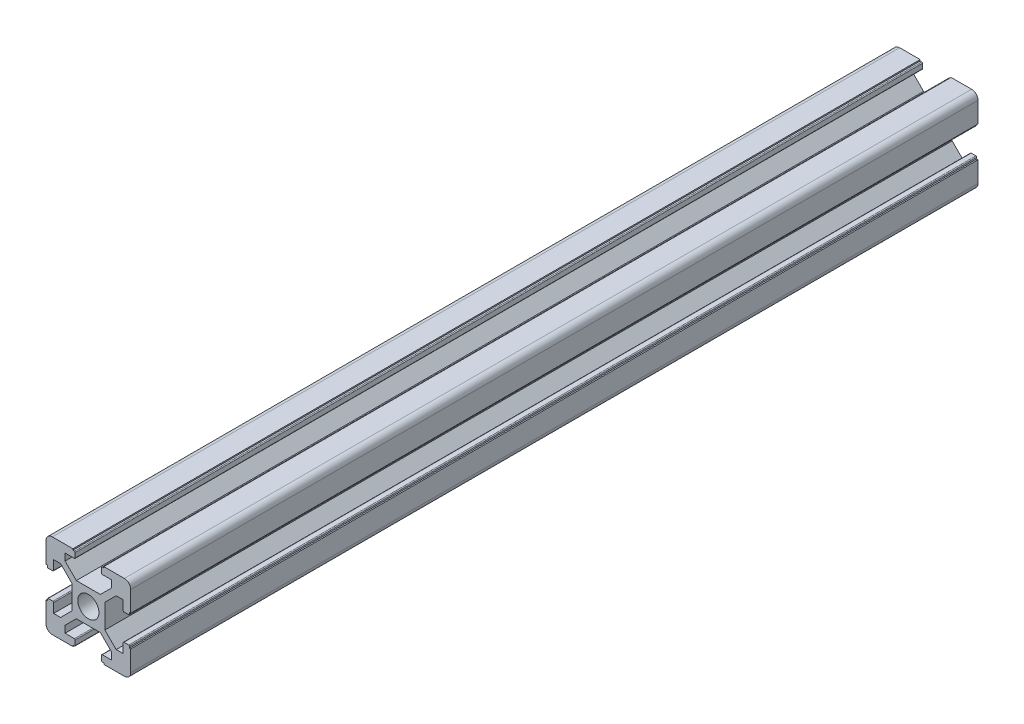
from build123d import *

# Parameters (mm, degrees)
SKETCH_1_R      = 2.5
EXTRUDE_2_DEPTH = 200
EXTRUDE_3_DEPTH = 200


with BuildPart() as part:
    # 草图1 → 凸台-拉伸2 (new body)
    with BuildSketch(Plane.XY):
        with BuildLine():
            Line((3.65, 10), (8.5, 10))
            ThreePointArc((8.5, 10), (9.560660172, 9.560660172), (10, 8.5))
            Line((10, 8.5), (10, 3.65))
            Line((10, 3.65), (8.2, 3.65))
            Line((8.2, 3.65), (8.2, 5.5))
            Line((8.2, 5.5), (6.560660172, 5.5))
            Line((6.560660172, 5.5), (3.9, 2.839339828))
            Line((3.9, 2.839339828), (3.9, -2.839339828))
            Line((3.9, -2.839339828), (6.560660172, -5.5))
            Line((6.560660172, -5.5), (8.2, -5.5))
            Line((8.2, -5.5), (8.2, -3.65))
            Line((8.2, -3.65), (10, -3.65))
            Line((10, -3.65), (10, -8.5))
            ThreePointArc((10, -8.5), (9.560660172, -9.560660172), (8.5, -10))
            Line((8.5, -10), (3.65, -10))
            Line((3.65, -10), (3.65, -8.2))
            Line((3.65, -8.2), (5.5, -8.2))
            Line((5.5, -8.2), (5.5, -6.560660172))
            Line((5.5, -6.560660172), (2.839339828, -3.9))
            Line((2.839339828, -3.9), (-2.839339828, -3.9))
            Line((-2.839339828, -3.9), (-5.5, -6.560660172))
            Line((-5.5, -6.560660172), (-5.5, -8.2))
            Line((-5.5, -8.2), (-3.65, -8.2))
            Line((-3.65, -8.2), (-3.65, -10))
            Line((-3.65, -10), (-8.5, -10))
            ThreePointArc((-8.5, -10), (-9.560660172, -9.560660172), (-10, -8.5))
            Line((-10, -8.5), (-10, -3.65))
            Line((-10, -3.65), (-8.2, -3.65))
            Line((-8.2, -3.65), (-8.2, -5.5))
            Line((-8.2, -5.5), (-6.560660172, -5.5))
            Line((-6.560660172, -5.5), (-3.9, -2.839339828))
            Line((-3.9, -2.839339828), (-3.9, 2.839339828))
            Line((-3.9, 2.839339828), (-6.560660172, 5.5))
            Line((-6.560660172, 5.5), (-8.2, 5.5))
            Line((-8.2, 5.5), (-8.2, 3.65))
            Line((-8.2, 3.65), (-10, 3.65))
            Line((-10, 3.65), (-10, 8.5))
            ThreePointArc((-10, 8.5), (-9.560660172, 9.560660172), (-8.5, 10))
            Line((-8.5, 10), (-3.65, 10))
            Line((-3.65, 10), (-3.65, 8.2))
            Line((-3.65, 8.2), (-5.5, 8.2))
            Line((-5.5, 8.2), (-5.5, 6.560660172))
            Line((-5.5, 6.560660172), (-2.839339828, 3.9))
            Line((-2.839339828, 3.9), (2.839339828, 3.9))
            Line((2.839339828, 3.9), (5.5, 6.560660172))
            Line((5.5, 6.560660172), (5.5, 8.2))
            Line((5.5, 8.2), (3.65, 8.2))
            Line((3.65, 8.2), (3.65, 10))
        make_face()
        Circle(SKETCH_1_R, mode=Mode.SUBTRACT)
    extrude(amount=EXTRUDE_2_DEPTH)

    # 草图3 → 凸台-拉伸3 (add)
    with BuildSketch(Plane.XY.offset(200)):
        with BuildLine():
            Line((-8.2, 3.65), (-9.7, 3.65))
            Line((-9.7, 3.65), (-9.7, 3.3))
            ThreePointArc((-9.7, 3.3), (-9.641421356, 3.158578644), (-9.5, 3.1))
            Line((-9.5, 3.1), (-8.4, 3.1))
            ThreePointArc((-8.4, 3.1), (-8.258578644, 3.158578644), (-8.2, 3.3))
            Line((-8.2, 3.3), (-8.2, 3.65))
        make_face()
        with BuildLine():
            Line((-3.65, 9.7), (-3.65, 8.2))
            Line((-3.65, 8.2), (-3.3, 8.2))
            ThreePointArc((-3.3, 8.2), (-3.158578644, 8.258578644), (-3.1, 8.4))
            Line((-3.1, 8.4), (-3.1, 9.5))
            ThreePointArc((-3.1, 9.5), (-3.158578644, 9.641421356), (-3.3, 9.7))
            Line((-3.3, 9.7), (-3.65, 9.7))
        make_face()
        with BuildLine():
            Line((3.65, 8.2), (3.65, 9.7))
            Line((3.65, 9.7), (3.3, 9.7))
            ThreePointArc((3.3, 9.7), (3.158578644, 9.641421356), (3.1, 9.5))
            Line((3.1, 9.5), (3.1, 8.4))
            ThreePointArc((3.1, 8.4), (3.158578644, 8.258578644), (3.3, 8.2))
            Line((3.3, 8.2), (3.65, 8.2))
        make_face()
        with BuildLine():
            Line((9.7, 3.65), (8.2, 3.65))
            Line((8.2, 3.65), (8.2, 3.3))
            ThreePointArc((8.2, 3.3), (8.258578644, 3.158578644), (8.4, 3.1))
            Line((8.4, 3.1), (9.5, 3.1))
            ThreePointArc((9.5, 3.1), (9.641421356, 3.158578644), (9.7, 3.3))
            Line((9.7, 3.3), (9.7, 3.65))
        make_face()
        with BuildLine():
            Line((3.65, -9.7), (3.65, -8.2))
            Line((3.65, -8.2), (3.3, -8.2))
            ThreePointArc((3.3, -8.2), (3.158578644, -8.258578644), (3.1, -8.4))
            Line((3.1, -8.4), (3.1, -9.5))
            ThreePointArc((3.1, -9.5), (3.158578644, -9.641421356), (3.3, -9.7))
            Line((3.3, -9.7), (3.65, -9.7))
        make_face()
        with BuildLine():
            Line((-3.65, -8.2), (-3.65, -9.7))
            Line((-3.65, -9.7), (-3.3, -9.7))
            ThreePointArc((-3.3, -9.7), (-3.158578644, -9.641421356), (-3.1, -9.5))
            Line((-3.1, -9.5), (-3.1, -8.4))
            ThreePointArc((-3.1, -8.4), (-3.158578644, -8.258578644), (-3.3, -8.2))
            Line((-3.3, -8.2), (-3.65, -8.2))
        make_face()
        with BuildLine():
            Line((8.2, -3.65), (8.2, -3.3))
            ThreePointArc((8.2, -3.3), (8.258578644, -3.158578644), (8.4, -3.1))
            Line((8.4, -3.1), (9.5, -3.1))
            ThreePointArc((9.5, -3.1), (9.641421356, -3.158578644), (9.7, -3.3))
            Line((9.7, -3.3), (9.7, -3.65))
            Line((9.7, -3.65), (8.2, -3.65))
        make_face()
        with BuildLine():
            Line((-8.2, -3.65), (-8.2, -3.3))
            ThreePointArc((-8.2, -3.3), (-8.258578644, -3.158578644), (-8.4, -3.1))
            Line((-8.4, -3.1), (-9.5, -3.1))
            ThreePointArc((-9.5, -3.1), (-9.641421356, -3.158578644), (-9.7, -3.3))
            Line((-9.7, -3.3), (-9.7, -3.65))
            Line((-9.7, -3.65), (-8.2, -3.65))
        make_face()
    extrude(amount=-EXTRUDE_3_DEPTH)


solid = part.part
